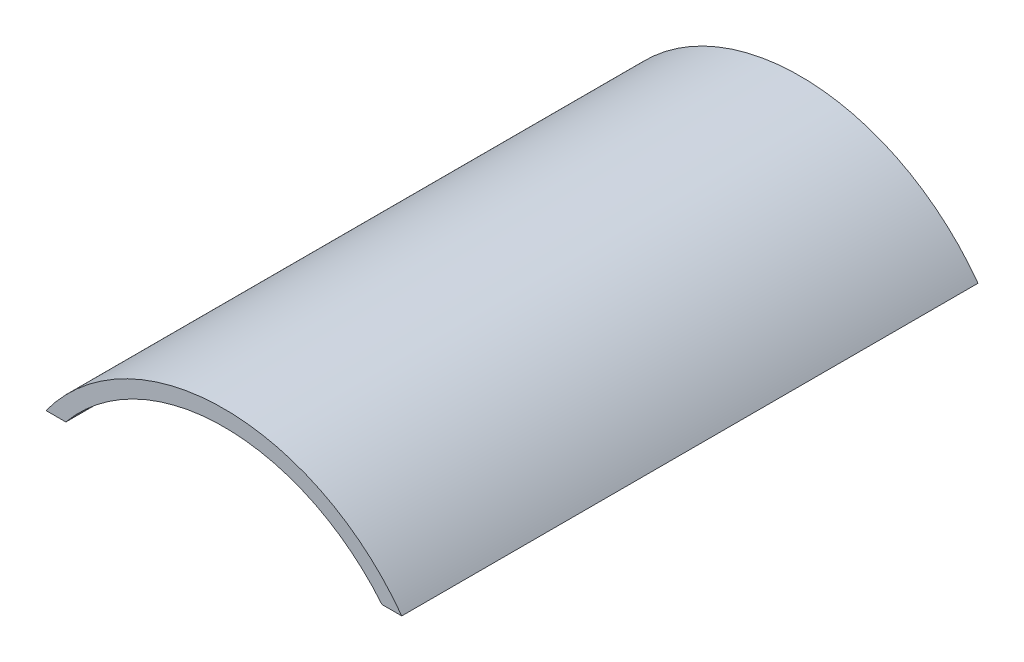
from build123d import *

# Parameters (mm, degrees)
BOSS_EXTRUDE1_DEPTH = 55


with BuildPart() as part:
    # Sketch1 → Boss-Extrude1 (new body)
    with BuildSketch(Plane.XY):
        with BuildLine():
            Line((-15.083884013, 12.358254047), (-16.978620583, 12.358254047))
            ThreePointArc((-16.978620583, 12.358254047), (0, 21), (16.978620583, 12.358254047))
            Line((16.978620583, 12.358254047), (15.083884013, 12.358254047))
            ThreePointArc((15.083884013, 12.358254047), (0, 19.5), (-15.083884013, 12.358254047))
        make_face()
    extrude(amount=BOSS_EXTRUDE1_DEPTH)


solid = part.part
